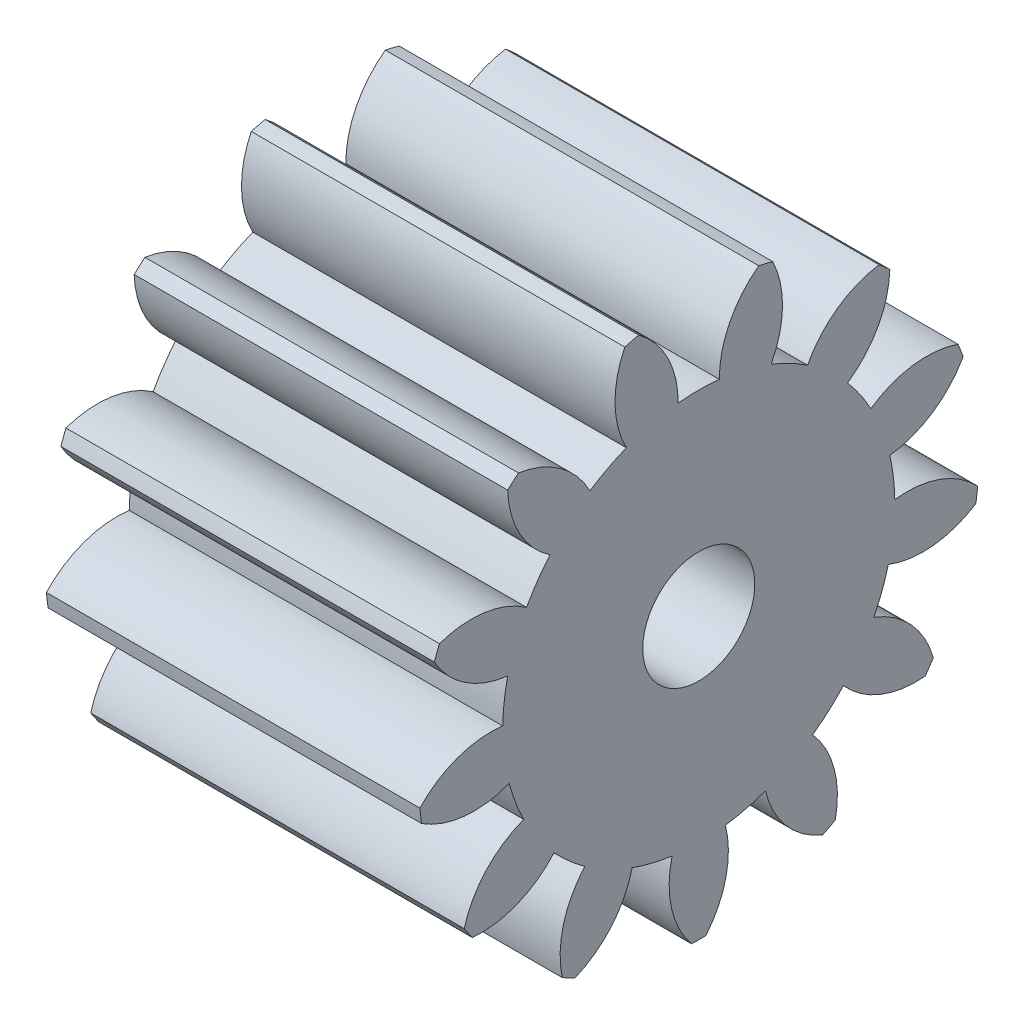
from build123d import *

# Parameters (mm, degrees)
SKETCH1_R           = 1.5
BOSS_EXTRUDE1_DEPTH = 10


with BuildPart() as part:
    # Sketch1 → Boss-Extrude1 (new body)
    with BuildSketch(Plane(origin=(8.280946038, 0, 0), x_dir=(0, 0, -1), z_dir=(1, 0, 0))):
        with BuildLine():
            ThreePointArc((-5.241118894, 5.469969331), (-4.922453486, 4.30124364), (-4.108826145, 3.403759416))
            ThreePointArc((-4.108826145, 3.403759416), (-4.445362123, 2.967158611), (-4.734253665, 2.497671227))
            ThreePointArc((-4.734253665, 2.497671227), (-5.861932223, 2.940173714), (-7.067710038, 2.823695205))
            ThreePointArc((-7.067710038, 2.823695205), (-7.138141631, 2.644923409), (-7.203970455, 2.464406012))
            ThreePointArc((-7.203970455, 2.464406012), (-6.37867234, 1.577642006), (-5.241159393, 1.161070671))
            ThreePointArc((-5.241159393, 1.161070671), (-5.336248691, 0.61808379), (-5.373867781, 0.068118763))
            ThreePointArc((-5.373867781, 0.068118763), (-6.578018715, -0.0641231), (-7.591551684, -0.727612588))
            ThreePointArc((-7.591551684, -0.727612588), (-7.570836367, -0.918638346), (-7.545234279, -1.109070743))
            ThreePointArc((-7.545234279, -1.109070743), (-6.402369308, -1.510726117), (-5.201561262, -1.350953091))
            ThreePointArc((-5.201561262, -1.350953091), (-5.033420069, -1.875934296), (-4.811148627, -2.380386606))
            ThreePointArc((-4.811148627, -2.380386606), (-5.815915469, -3.057077802), (-6.405015404, -4.115580825))
            ThreePointArc((-6.405015404, -4.115580825), (-6.297898805, -4.275098845), (-6.186730935, -4.431820474))
            ThreePointArc((-6.186730935, -4.431820474), (-4.9881157, -4.256352811), (-3.999103208, -3.556837498))
            ThreePointArc((-3.999103208, -3.556837498), (-3.606250644, -3.943546161), (-3.175008379, -4.286921809))
            ThreePointArc((-3.175008379, -4.286921809), (-3.750211154, -5.35304054), (-3.77992236, -6.56406681))
            ThreePointArc((-3.77992236, -6.56406681), (-3.610943601, -6.655533437), (-3.439677168, -6.742641262))
            ThreePointArc((-3.439677168, -6.742641262), (-2.459899975, -6.030248089), (-1.909253879, -4.951241018))
            ThreePointArc((-1.909253879, -4.951241018), (-1.381687733, -5.111086844), (-0.84026705, -5.214722607))
            ThreePointArc((-0.84026705, -5.214722607), (-0.854133735, -6.42603392), (-0.317649732, -7.512151913))
            ThreePointArc((-0.317649732, -7.512151913), (-0.125519811, -7.514613244), (0.06661011, -7.512151913))
            ThreePointArc((0.06661011, -7.512151913), (0.603094113, -6.42603392), (0.589227428, -5.214722607))
            ThreePointArc((0.589227428, -5.214722607), (1.130648111, -5.111086844), (1.658214257, -4.951241018))
            ThreePointArc((1.658214257, -4.951241018), (2.208860353, -6.030248089), (3.188637546, -6.742641262))
            ThreePointArc((3.188637546, -6.742641262), (3.359903979, -6.655533437), (3.528882738, -6.56406681))
            ThreePointArc((3.528882738, -6.56406681), (3.499171532, -5.35304054), (2.923968757, -4.286921809))
            ThreePointArc((2.923968757, -4.286921809), (3.355211022, -3.943546161), (3.748063586, -3.556837498))
            ThreePointArc((3.748063586, -3.556837498), (4.737076078, -4.256352811), (5.935691313, -4.431820474))
            ThreePointArc((5.935691313, -4.431820474), (6.046859183, -4.275098845), (6.153975782, -4.115580825))
            ThreePointArc((6.153975782, -4.115580825), (5.564875847, -3.057077802), (4.560109005, -2.380386606))
            ThreePointArc((4.560109005, -2.380386606), (4.782380447, -1.875934296), (4.95052164, -1.350953091))
            ThreePointArc((4.95052164, -1.350953091), (6.151329686, -1.510726117), (7.294194657, -1.109070743))
            ThreePointArc((7.294194657, -1.109070743), (7.319796745, -0.918638346), (7.340512062, -0.727612588))
            ThreePointArc((7.340512062, -0.727612588), (6.326979093, -0.0641231), (5.122828159, 0.068118763))
            ThreePointArc((5.122828159, 0.068118763), (5.085209069, 0.61808379), (4.990119771, 1.161070671))
            ThreePointArc((4.990119771, 1.161070671), (6.127632718, 1.577642006), (6.952930834, 2.464406012))
            ThreePointArc((6.952930834, 2.464406012), (6.887102009, 2.644923409), (6.816670416, 2.823695205))
            ThreePointArc((6.816670416, 2.823695205), (5.610892601, 2.940173714), (4.483214043, 2.497671227))
            ThreePointArc((4.483214043, 2.497671227), (4.194322501, 2.967158611), (3.857786523, 3.403759416))
            ThreePointArc((3.857786523, 3.403759416), (4.671413864, 4.30124364), (4.990079272, 5.469969331))
            ThreePointArc((4.990079272, 5.469969331), (4.847900126, 5.599217367), (4.702456651, 5.724780738))
            ThreePointArc((4.702456651, 5.724780738), (3.580663157, 5.267564445), (2.787794542, 4.351689595))
            ThreePointArc((2.787794542, 4.351689595), (2.313812119, 4.633145434), (1.812925799, 4.863340181))
            ThreePointArc((1.812925799, 4.863340181), (2.116275315, 6.036134474), (1.85530561, 7.219080878))
            ThreePointArc((1.85530561, 7.219080878), (1.669347671, 7.267450386), (1.482211662, 7.311040277))
            ThreePointArc((1.482211662, 7.311040277), (0.701391859, 6.384871924), (0.424969832, 5.205440601))
            ThreePointArc((0.424969832, 5.205440601), (-0.125519811, 5.234386756), (-0.676009454, 5.205440601))
            ThreePointArc((-0.676009454, 5.205440601), (-0.952431481, 6.384871924), (-1.733251284, 7.311040277))
            ThreePointArc((-1.733251284, 7.311040277), (-1.920387293, 7.267450386), (-2.106345232, 7.219080878))
            ThreePointArc((-2.106345232, 7.219080878), (-2.367314937, 6.036134474), (-2.063965421, 4.863340181))
            ThreePointArc((-2.063965421, 4.863340181), (-2.564851741, 4.633145434), (-3.038834164, 4.351689595))
            ThreePointArc((-3.038834164, 4.351689595), (-3.831702779, 5.267564445), (-4.953496273, 5.724780738))
            ThreePointArc((-4.953496273, 5.724780738), (-5.098939748, 5.599217367), (-5.241118894, 5.469969331))
        make_face()
        with Locations(Location((-0.125519811, -0.014613244, 0), (0, 0, 180))):
            Circle(SKETCH1_R, mode=Mode.SUBTRACT)
    extrude(amount=-BOSS_EXTRUDE1_DEPTH)


solid = part.part
